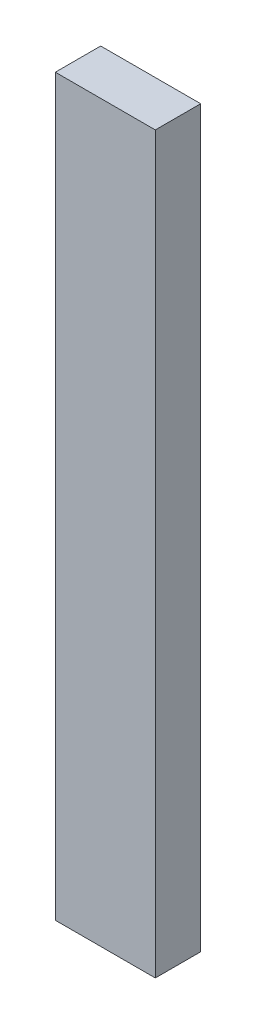
from build123d import *

# Parameters (mm, degrees)
SKETCH1_W           = 54
SKETCH1_H           = 24.5
BOSS_EXTRUDE1_DEPTH = 396.7


with BuildPart() as part:
    # Sketch1 → Boss-Extrude1 (new body)
    with BuildSketch(Plane(origin=(0, 0, 0), x_dir=(1, 0, 0), z_dir=(0, 1, 0))):
        with Locations((27, 12.25)):
            Rectangle(SKETCH1_W, SKETCH1_H)
    extrude(amount=BOSS_EXTRUDE1_DEPTH)


solid = part.part
